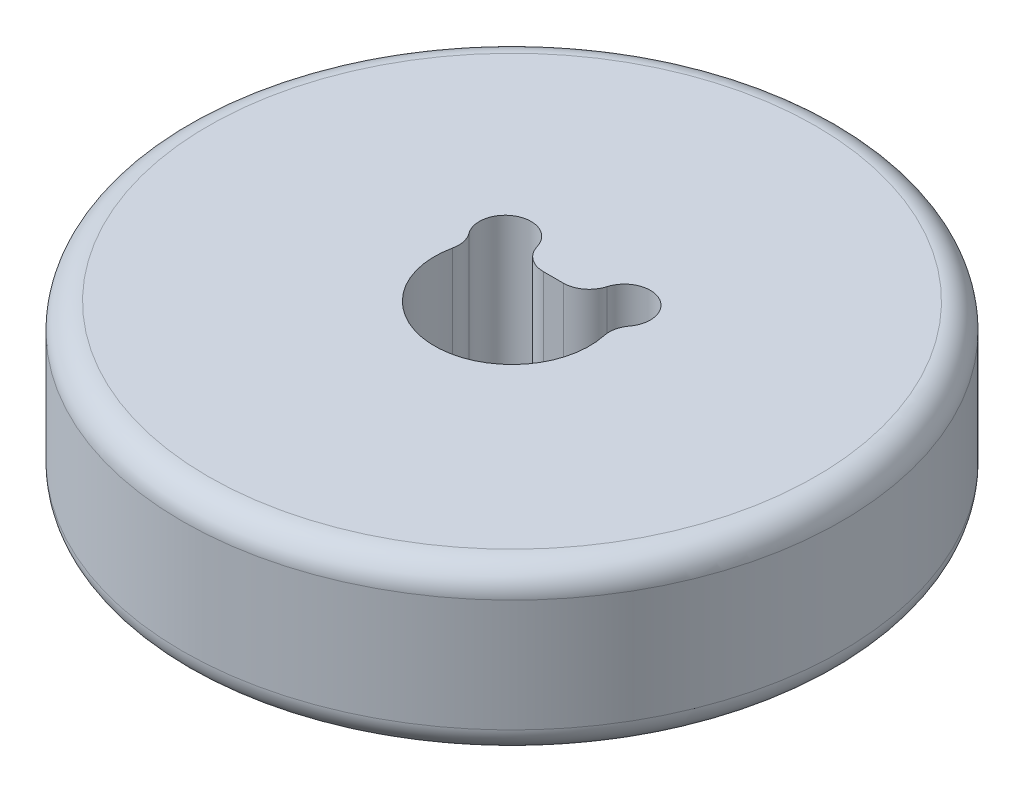
from build123d import *

# Parameters (mm, degrees)
SKETCH1_R           = 12.75
BOSS_EXTRUDE1_DEPTH = 6.35
FILLET1_R           = 1
FILLET2_R           = 1


with BuildPart() as part:
    # Sketch1 → Boss-Extrude1 (new body)
    with BuildSketch(Plane(origin=(0, 0, 0), x_dir=(1, 0, 0), z_dir=(0, 1, 0))):
        with Locations(Location((0, 0, 0), (0, 0, 270))):
            Circle(SKETCH1_R)
        with BuildLine():
            Line((1.411048864, 1.6), (-1.411048864, 1.6))
            ThreePointArc((-1.411048864, 1.6), (-2.617971935, 2.994195507), (-2.768208587, 1.156296337))
            ThreePointArc((-2.768208587, 1.156296337), (0, -3), (2.768208587, 1.156296337))
            ThreePointArc((2.768208587, 1.156296337), (2.617971935, 2.994195507), (1.411048864, 1.6))
        make_face(mode=Mode.SUBTRACT)
    extrude(amount=BOSS_EXTRUDE1_DEPTH)

    # Fillet1
    fillet1_edges = [part.edges().sort_by_distance(p)[0] for p in [
        (2.768208587, 3.175, -1.156296337),
        (1.411048864, 3.175, -1.6),
        (-1.411048864, 3.175, -1.6),
        (-2.768208587, 3.175, -1.156296337),
    ]]
    fillet(fillet1_edges, radius=FILLET1_R)

    # Fillet2
    fillet2_edges = [part.edges().sort_by_distance(p)[0] for p in [
        (0, 0, -12.75),
        (0, 6.35, -12.75),
    ]]
    fillet(fillet2_edges, radius=FILLET2_R)


solid = part.part
